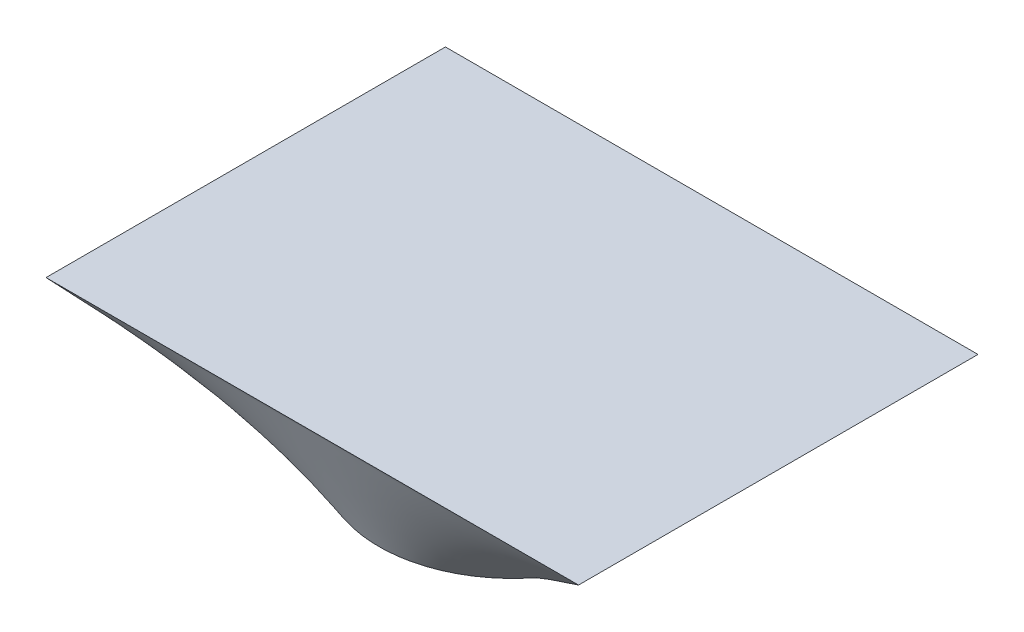
from build123d import *


with BuildPart() as part:
    # Çizim4 for Loft11 → Loft11 section 0
    with BuildSketch(Plane(origin=(0, 0, 0), x_dir=(1, 0, 0), z_dir=(0, 1, 0))):
        with BuildLine():
            # circular arc as an exact rational Bezier (weights 1, cos(half-angle), 1)
            Bezier((80, -60), (0, -166.666666667), (-80, -60), weights=[1, 0.6, 1])
            Bezier((-80, -60), (-125, 0), (-80, 60), weights=[1, 0.8, 1])
            Bezier((-80, 60), (0, 166.666666667), (80, 60), weights=[1, 0.6, 1])
            Bezier((80, 60), (125, 0), (80, -60), weights=[1, 0.8, 1])
        make_face()
    # Çizim6 → Loft11 section 1
    with BuildSketch(Plane(origin=(0, 100, 0), x_dir=(1, 0, 0), z_dir=(0, 1, 0))):
        with BuildLine():
            Line((200, -150), (-200, -150))
            Line((-200, -150), (-200, 150))
            Line((-200, 150), (200, 150))
            Line((200, 150), (200, -150))
        make_face()
    loft()


solid = part.part
